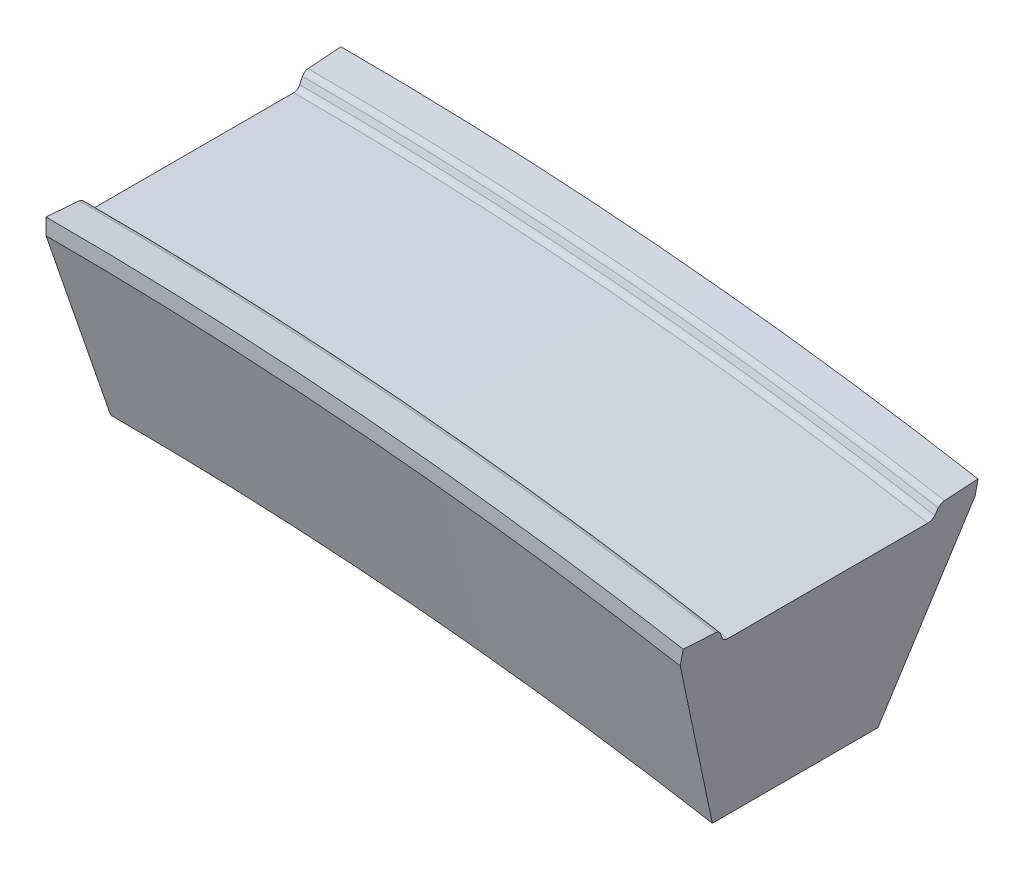
from build123d import *

# Parameters (mm, degrees)
CROQUIS2_R                        = 2.1
CORTAR_EXTRUIR1_DEPTH             = 406.488213274
MATRIZC1_COUNT                    = 36
CORTAR_EXTRUIR5_REACH             = 679.172
CROQUIS4_R                        = 4.2
CORTAR_EXTRUIR5_DIRECTION_2_REACH = 679.172
REVOLUCI_N3_ANGLE                 = 10


with BuildPart() as part:
    # Croquis1 → Revolución2 (revolve)
    with BuildSketch(Plane(origin=(0, 0, 0), x_dir=(0, 0, -1), z_dir=(1, 0, 0)), mode=Mode.PRIVATE) as revoluci_n2_sk:
        with BuildLine():
            Line((-7.932667948, 272.794817661), (-8.128235692, 273.229412649))
            ThreePointArc((-8.128235692, 273.229412649), (-8.296797496, 273.433378016), (-8.545848195, 273.522757553))
            Line((-8.545848195, 273.522757553), (-12.682817286, 273.840985945))
            ThreePointArc((-12.682817286, 273.840985945), (-14.22986011, 274.537339899), (-14.976158002, 276.060917854))
            Line((-14.976158002, 276.060917854), (-16, 285.390918278))
            ThreePointArc((-16, 285.390918278), (-14.380212317, 286.280019748), (-14.896885493, 284.505967215))
            Line((-14.896885493, 284.505967215), (-14.369495262, 279.7))
            ThreePointArc((-14.369495262, 279.7), (-11.00403892, 278.246015718), (-9.3, 275))
            ThreePointArc((-9.3, 275), (-4.661345964, 274.499260763), (0, 274.3))
            ThreePointArc((0, 274.3), (4.661345964, 274.499260763), (9.3, 275))
            ThreePointArc((9.3, 275), (11.00403892, 278.246015718), (14.369495262, 279.7))
            Line((14.369495262, 279.7), (14.896885493, 284.505967215))
            ThreePointArc((14.896885493, 284.505967215), (14.380212317, 286.280019748), (16, 285.390918278))
            Line((16, 285.390918278), (14.976158002, 276.060917854))
            ThreePointArc((14.976158002, 276.060917854), (14.22986011, 274.537339899), (12.682817286, 273.840985945))
            Line((12.682817286, 273.840985945), (8.545848195, 273.522757553))
            ThreePointArc((8.545848195, 273.522757553), (8.296797496, 273.433378016), (8.128235692, 273.229412649))
            Line((8.128235692, 273.229412649), (7.932667948, 272.794817661))
            ThreePointArc((7.932667948, 272.794817661), (7.748192766, 272.580124322), (7.476707195, 272.5))
            Line((7.476707195, 272.5), (-7.476707195, 272.5))
            ThreePointArc((-7.476707195, 272.5), (-7.748192766, 272.580124322), (-7.932667948, 272.794817661))
        make_face()
    revolve(revoluci_n2_sk.sketch.rotate(Axis((0, 0, 417.631684514), (0, 0, -1)), 180), axis=Axis((0, 0, 417.631684514), (0, 0, -1)))

    # Croquis2 → Cortar-Extruir1 (cut, through all)
    with BuildSketch(Plane(origin=(0, 0, 0), x_dir=(1, 0, 0), z_dir=(0, 1, 0))):
        with Locations(Location((0, 0, 0), (0, 0, 270))):
            Circle(CROQUIS2_R)
    cortar_extruir1 = extrude(amount=-CORTAR_EXTRUIR1_DEPTH, mode=Mode.SUBTRACT)

    # MatrizC1: Cortar-Extruir1 ×36 about axis
    matrizc1_axis = Axis((0, 0, 0), (0, 0, 1))
    for i in range(1, MATRIZC1_COUNT):
        add(cortar_extruir1.rotate(matrizc1_axis, i * 360 / MATRIZC1_COUNT), mode=Mode.SUBTRACT)

    # Croquis4 → Cortar-Extruir5 (cut, up to next)
    with BuildSketch(Plane(origin=(-224.693405748, 157.332016491, 0), x_dir=(0, 0, -1), z_dir=(-0.8191520442889971, 0.5735764363510386, 0)), mode=Mode.PRIVATE) as cortar_extruir5_sk1:
        Circle(CROQUIS4_R)
    cortar_extruir5_tool1 = extrude(cortar_extruir5_sk1.sketch, amount=-CORTAR_EXTRUIR5_REACH, mode=Mode.PRIVATE) & part.part
    add(cortar_extruir5_tool1.solids().sort_by_distance((-224.693406, 157.332016, 0))[0], mode=Mode.SUBTRACT)

    # Croquis4 → Cortar-Extruir5 direction 2 (cut, up to next)
    with BuildSketch(Plane(origin=(-224.693405748, 157.332016491, 0), x_dir=(0, 0, -1), z_dir=(-0.8191520442889971, 0.5735764363510386, 0)), mode=Mode.PRIVATE) as cortar_extruir5_direction_2_sk1:
        Circle(CROQUIS4_R)
    cortar_extruir5_direction_2_tool1 = extrude(cortar_extruir5_direction_2_sk1.sketch, amount=CORTAR_EXTRUIR5_DIRECTION_2_REACH, mode=Mode.PRIVATE) & part.part
    add(cortar_extruir5_direction_2_tool1.solids().sort_by_distance((-224.693406, 157.332016, 0))[0], mode=Mode.SUBTRACT)


with BuildPart() as body_2:
    # Croquis5 → Revolución3 (revolve)
    with BuildSketch(Plane(origin=(0, 0, 0), x_dir=(0, 0, -1), z_dir=(1, 0, 0))):
        with BuildLine():
            Line((-11, 273.711538462), (-11, 272.5))
            Line((-11, 272.5), (-7.476707195, 272.5))
            ThreePointArc((-7.476707195, 272.5), (-7.748192766, 272.580124322), (-7.932667948, 272.794817661))
            Line((-7.932667948, 272.794817661), (-8.128235692, 273.229412649))
            ThreePointArc((-8.128235692, 273.229412649), (-8.296797496, 273.433378016), (-8.545848195, 273.522757553))
            Line((-8.545848195, 273.522757553), (-11, 273.711538462))
        make_face()
        Polygon((-7.476707195, 272.5), (-11, 272.5), (-6.179413414, 258.5), (0, 258.5), (0, 272.5), align=None)
        Polygon((7.476707195, 272.5), (0, 272.5), (0, 258.5), (6.179413414, 258.5), (11, 272.5), align=None)
        with BuildLine():
            ThreePointArc((7.932667948, 272.794817661), (7.748192766, 272.580124322), (7.476707195, 272.5))
            Line((7.476707195, 272.5), (11, 272.5))
            Line((11, 272.5), (11, 273.711538462))
            Line((11, 273.711538462), (8.545848195, 273.522757553))
            ThreePointArc((8.545848195, 273.522757553), (8.296797496, 273.433378016), (8.128235692, 273.229412649))
            Line((8.128235692, 273.229412649), (7.932667948, 272.794817661))
        make_face()
    revolve(axis=Axis((0, 0, 417.631684514), (0, 0, -1)), revolution_arc=REVOLUCI_N3_ANGLE)


solid = body_2.part
